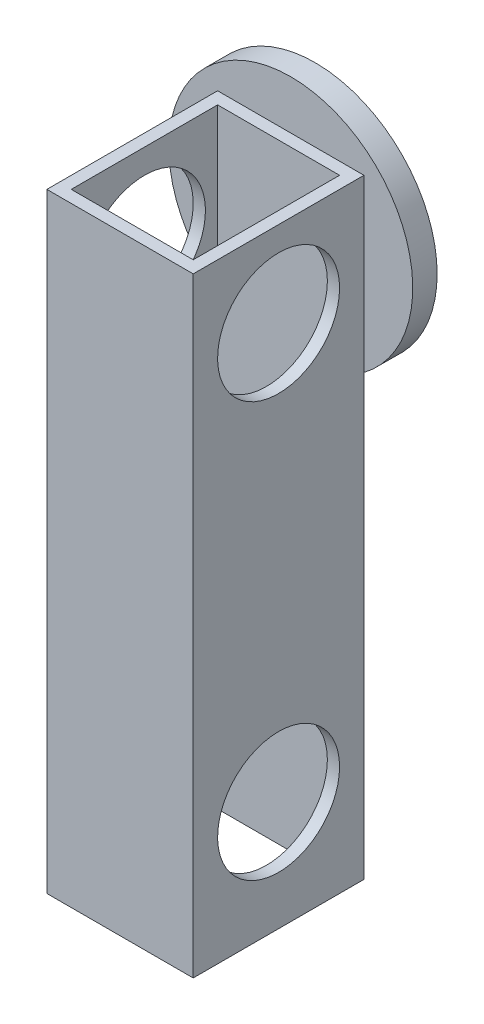
from build123d import *

# Parameters (mm, degrees)
SKETCH_1_R          = 50
EXTRUDE_1_DEPTH     = 10
SKETCH_3_W          = 60
SKETCH_3_H          = 60
EXTRUDE_2_DEPTH     = 70
SKETCH_4_W          = 60
SKETCH_4_H          = 70
EXTRUDE_3_DEPTH     = 190
SKETCH_5_R          = 25
CUT_EXTRUDE_4_DEPTH = 190
SKETCH_6_W          = 50
SKETCH_6_H          = 60
CUT_EXTRUDE_5_DEPTH = 287.006992922


with BuildPart() as part:
    # 草图1 → 凸台-拉伸1 (new body)
    with BuildSketch(Plane.XY):
        Circle(SKETCH_1_R)
    extrude(amount=EXTRUDE_1_DEPTH)

    # 草图3 → 凸台-拉伸2 (add)
    with BuildSketch(Plane.XY.offset(10)):
        Rectangle(SKETCH_3_W, SKETCH_3_H)
    extrude(amount=EXTRUDE_2_DEPTH)

    # 草图4 → 凸台-拉伸3 (add)
    with BuildSketch(Plane.XZ.offset(30)):
        with Locations((0, 45)):
            Rectangle(SKETCH_4_W, SKETCH_4_H)
    extrude(amount=EXTRUDE_3_DEPTH)

    # 草图5 → 切除-拉伸4 (cut)
    with BuildSketch(Plane.ZY.offset(30)):
        with Locations(Location((45, -5, 0), (0, 0, 270))):
            Circle(SKETCH_5_R)
        with Locations(Location((45, -175, 0), (0, 0, 270))):
            Circle(SKETCH_5_R)
    extrude(amount=-CUT_EXTRUDE_4_DEPTH, mode=Mode.SUBTRACT)

    # 草图6 → 切除-拉伸5 (cut, through all)
    with BuildSketch(Plane.XZ.offset(220)):
        with Locations((0, 45)):
            Rectangle(SKETCH_6_W, SKETCH_6_H)
    extrude(amount=-CUT_EXTRUDE_5_DEPTH, mode=Mode.SUBTRACT)


solid = part.part
